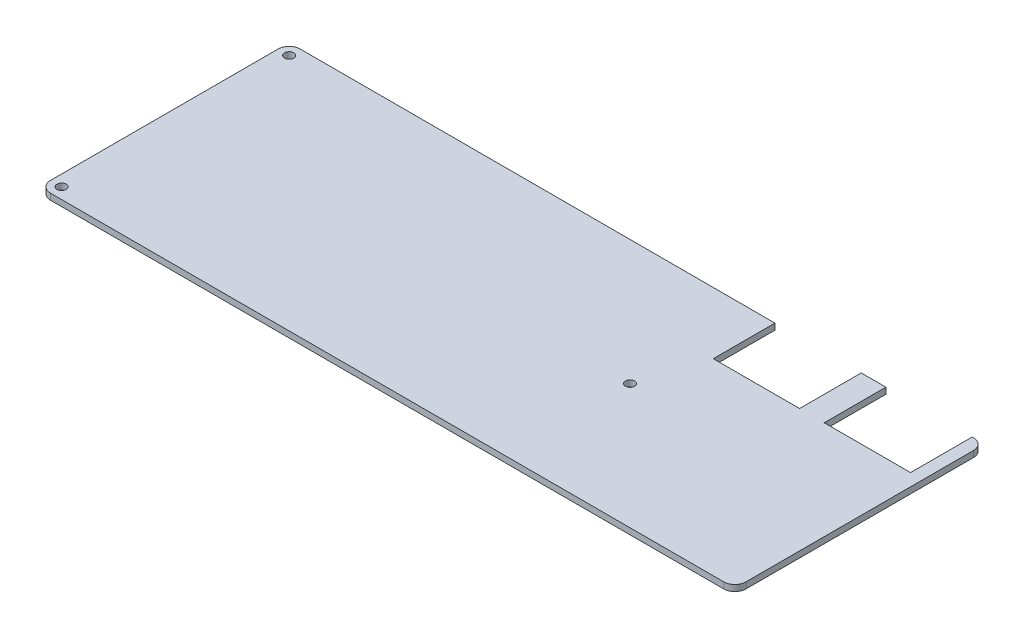
from build123d import *

# Parameters (mm, degrees)
SKETCH_1_R      = 0.75
EXTRUDE_2_DEPTH = 1


with BuildPart() as part:
    # 草图1 → 凸台-拉伸2 (new body)
    with BuildSketch(Plane(origin=(0, 0, 0), x_dir=(1, 0, 0), z_dir=(0, 1, 0))):
        with BuildLine():
            Line((23.799708029, 17.537518248), (-53.200291971, 17.537518248))
            ThreePointArc((-53.200291971, 17.537518248), (-54.473084177, 17.010310454), (-55.000291971, 15.737518248))
            Line((-55.000291971, 15.737518248), (-55.000291971, -21.162481752))
            ThreePointArc((-55.000291971, -21.162481752), (-54.473084177, -22.435273958), (-53.200291971, -22.962481752))
            Line((-53.200291971, -22.962481752), (55.999708029, -22.962481752))
            ThreePointArc((55.999708029, -22.962481752), (57.272500235, -22.435273958), (57.799708029, -21.162481752))
            Line((57.799708029, -21.162481752), (57.799708029, 15.737518248))
            ThreePointArc((57.799708029, 15.737518248), (57.272500235, 17.010310454), (55.999708029, 17.537518248))
            Line((55.999708029, 17.537518248), (55.799708029, 17.537518248))
            Line((55.799708029, 17.537518248), (55.799708029, 7.537518248))
            Line((55.799708029, 7.537518248), (41.799708029, 7.537518248))
            Line((41.799708029, 7.537518248), (41.799708029, 17.537518248))
            Line((41.799708029, 17.537518248), (37.799708029, 17.537518248))
            Line((37.799708029, 17.537518248), (37.799708029, 7.537518248))
            Line((37.799708029, 7.537518248), (23.799708029, 7.537518248))
            Line((23.799708029, 7.537518248), (23.799708029, 17.537518248))
        make_face()
        with Locations(Location((-53.200291971, -21.162481752, 0), (0, 0, 270))):
            Circle(SKETCH_1_R, mode=Mode.SUBTRACT)
        with Locations(Location((20.549708029, -2.712481752, 0), (0, 0, 270))):
            Circle(SKETCH_1_R, mode=Mode.SUBTRACT)
        with Locations(Location((-53.200291971, 15.737518248, 0), (0, 0, 270))):
            Circle(SKETCH_1_R, mode=Mode.SUBTRACT)
    extrude(amount=EXTRUDE_2_DEPTH)


solid = part.part
